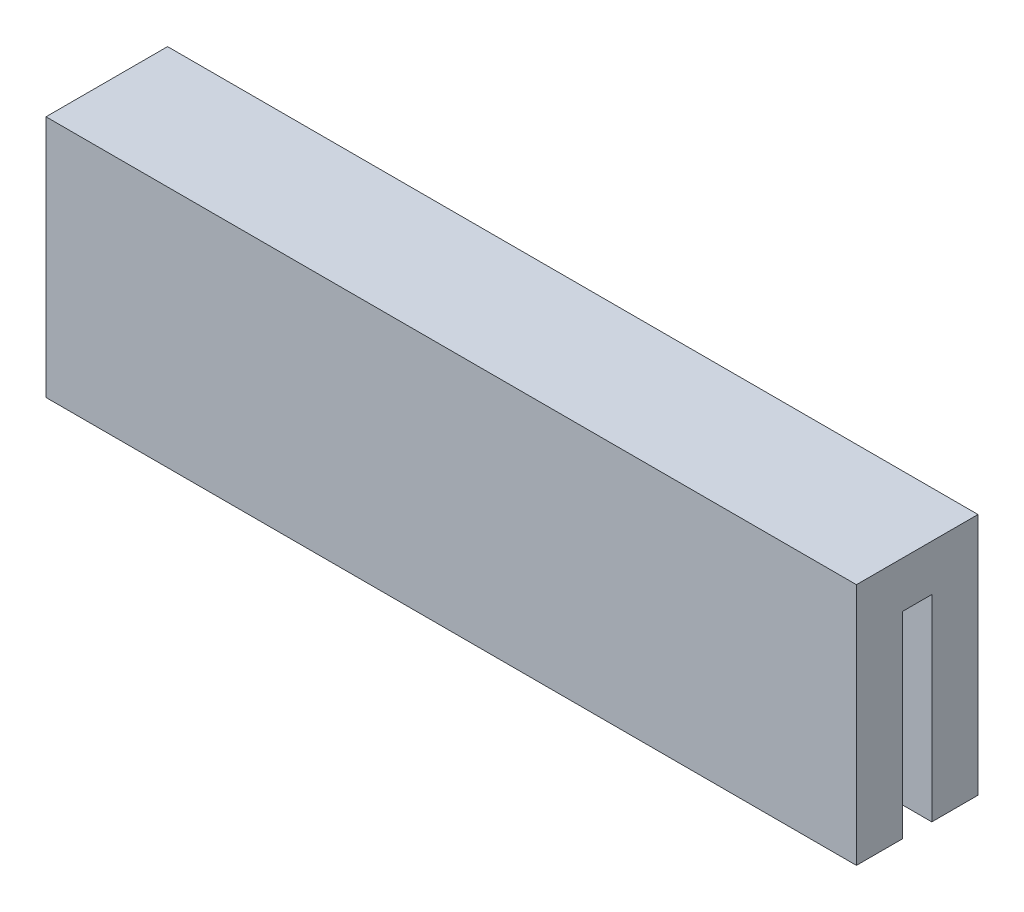
from build123d import *

# Parameters (mm, degrees)
ESQUISSE1_W             = 100
ESQUISSE1_H             = 15
BOSS_EXTRU_1_DEPTH      = 30
ESQUISSE2_W             = 100
ESQUISSE2_H             = 3.6
ENL_V_MAT_EXTRU_1_DEPTH = 24.3


with BuildPart() as part:
    # Esquisse1 → Boss.-Extru.1 (new body)
    with BuildSketch(Plane(origin=(0, 0, 0), x_dir=(1, 0, 0), z_dir=(0, 1, 0))):
        with Locations((50, -7.5)):
            Rectangle(ESQUISSE1_W, ESQUISSE1_H)
    extrude(amount=BOSS_EXTRU_1_DEPTH)

    # Esquisse2 → Enlèv. mat.-Extru.1 (cut)
    with BuildSketch(Plane.XZ):
        with Locations((50, 7.5)):
            Rectangle(ESQUISSE2_W, ESQUISSE2_H)
    extrude(amount=-ENL_V_MAT_EXTRU_1_DEPTH, mode=Mode.SUBTRACT)


solid = part.part
